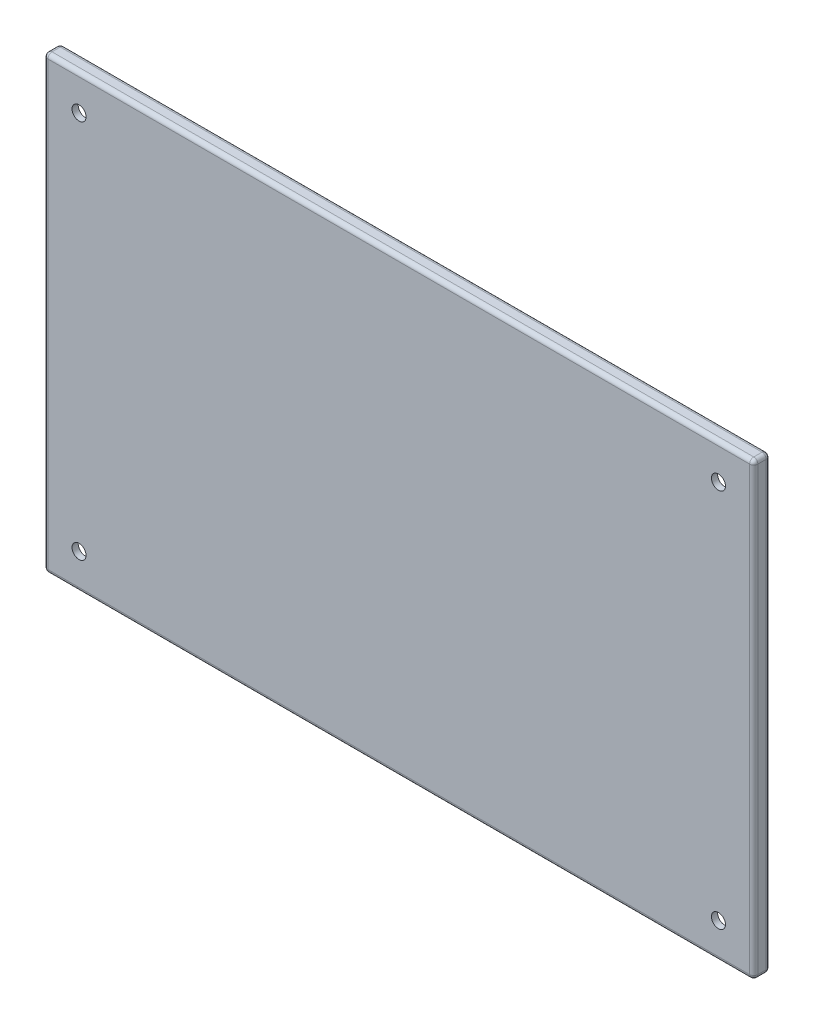
from build123d import *

# Parameters (mm, degrees)
SKETCH1_W           = 165
SKETCH1_H           = 102.1
SKETCH1_R           = 1.7
BOSS_EXTRUDE1_DEPTH = 1.5
SKETCH2_W           = 172
SKETCH2_H           = 109.1
SKETCH2_W_2         = 165
SKETCH2_H_2         = 102.1
BOSS_EXTRUDE2_DEPTH = 4
SKETCH3_W           = 165
SKETCH3_H           = 1
CUT_EXTRUDE1_DEPTH  = 2.5
FILLET1_R           = 1


with BuildPart() as part:
    # Sketch1 → Boss-Extrude1 (new body)
    with BuildSketch(Plane.XY):
        Rectangle(SKETCH1_W, SKETCH1_H)
        with Locations((-77.45, 46)):
            Circle(SKETCH1_R, mode=Mode.SUBTRACT)
        with Locations(Location((77.45, 46, 0), (0, 0, 180))):
            Circle(SKETCH1_R, mode=Mode.SUBTRACT)
        with Locations((77.45, -46)):
            Circle(SKETCH1_R, mode=Mode.SUBTRACT)
        with Locations(Location((-77.45, -46, 0), (0, 0, 180))):
            Circle(SKETCH1_R, mode=Mode.SUBTRACT)
    extrude(amount=BOSS_EXTRUDE1_DEPTH)

    # Sketch2 → Boss-Extrude2 (add)
    with BuildSketch(Plane.XY.offset(1.5)):
        Rectangle(SKETCH2_W, SKETCH2_H)
        Rectangle(SKETCH2_W_2, SKETCH2_H_2, mode=Mode.SUBTRACT)
    extrude(amount=-BOSS_EXTRUDE2_DEPTH)

    # Sketch3 → Cut-Extrude1 (cut)
    with BuildSketch(Plane(origin=(0, 0, -2.5), x_dir=(-1, 0, 0), z_dir=(0, 0, -1))):
        with Locations((0, 51.55)):
            Rectangle(SKETCH3_W, SKETCH3_H)
    extrude(amount=-CUT_EXTRUDE1_DEPTH, mode=Mode.SUBTRACT)

    # Fillet1
    fillet1_edges = [part.edges().sort_by_distance(p)[0] for p in [
        (-86, 0, -2.5),
        (-86, -54.55, -0.5),
        (0, 54.55, -2.5),
        (-86, 54.55, -0.5),
        (86, 0, -2.5),
        (86, 54.55, -0.5),
        (0, -54.55, -2.5),
        (86, -54.55, -0.5),
        (-86, 0, 1.5),
        (0, -54.55, 1.5),
        (86, 0, 1.5),
        (0, 54.55, 1.5),
    ]]
    fillet(fillet1_edges, radius=FILLET1_R)


solid = part.part
